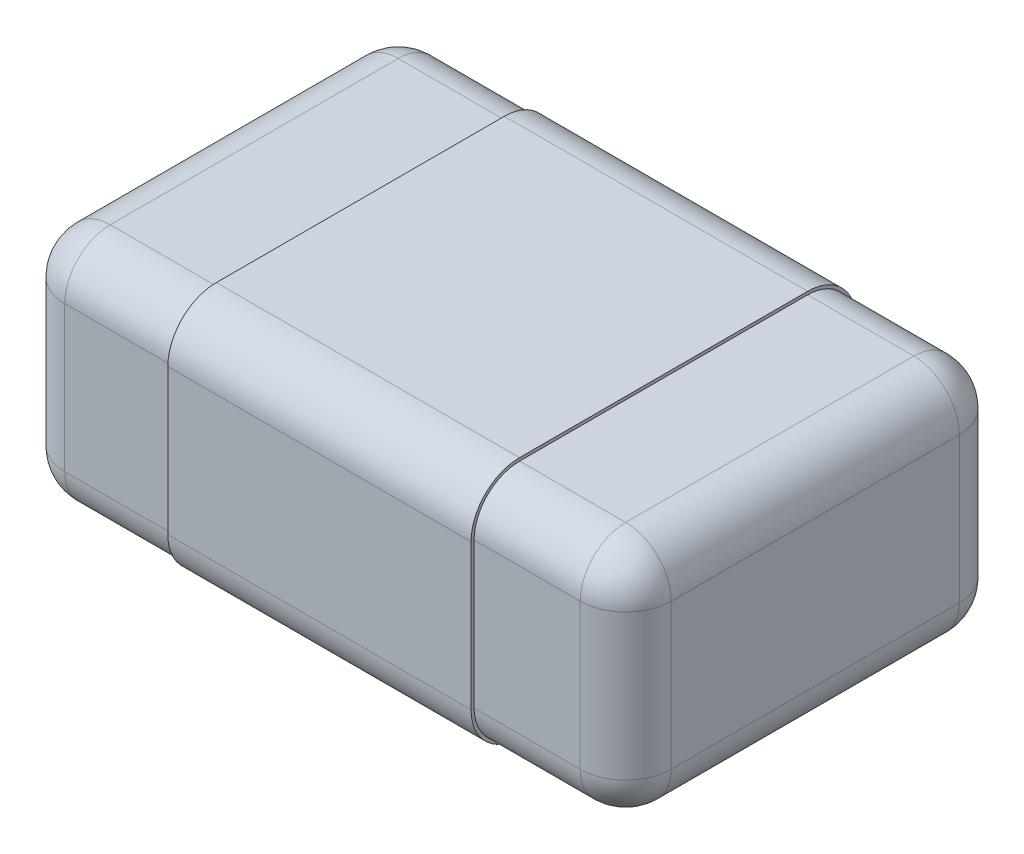
from build123d import *

# Parameters (mm, degrees)
ESBO_O1_W                     = 2
ESBO_O1_H                     = 1.25
RESSALTO_EXTRUS_O1_DEPTH      = 0.78
FILETE1_R                     = 0.15
RESSALTO_EXTRUS_O4_DEPTH      = 0.5
RESSALTO_EXTRUS_O4_DEPTH_BACK = 0.5


with BuildPart() as part:
    # Esboço1 → Ressalto-extrusão1 (new body)
    with BuildSketch(Plane(origin=(0, 0, 0), x_dir=(1, 0, 0), z_dir=(0, 1, 0))):
        Rectangle(ESBO_O1_W, ESBO_O1_H)
    extrude(amount=-RESSALTO_EXTRUS_O1_DEPTH)

    # Filete1
    filete1_edges = [part.edges().sort_by_distance(p)[0] for p in [
        (1, -0.78, 0),
        (0, -0.78, -0.625),
        (-1, -0.78, 0),
        (0, 0, -0.625),
        (1, 0, 0),
        (0, 0, 0.625),
        (-1, 0, 0),
        (0, -0.78, 0.625),
        (-1, -0.39, -0.625),
        (1, -0.39, -0.625),
        (1, -0.39, 0.625),
        (-1, -0.39, 0.625),
    ]]
    fillet(filete1_edges, radius=FILETE1_R)

    # Esboço4 → Ressalto-extrusão4 (add, two sides: drawn at the far end of the back side and taken through both)
    with BuildSketch(Plane(origin=(0, 0, 0), x_dir=(0, 0, -1), z_dir=(1, 0, 0)).offset(-RESSALTO_EXTRUS_O4_DEPTH_BACK)):
        with BuildLine():
            Line((0.635, -0.63), (0.635, -0.15))
            ThreePointArc((0.635, -0.15), (0.588137085, -0.036862915), (0.475, 0.01))
            Line((0.475, 0.01), (-0.475, 0.01))
            ThreePointArc((-0.475, 0.01), (-0.588137085, -0.036862915), (-0.635, -0.15))
            Line((-0.635, -0.15), (-0.635, -0.63))
            ThreePointArc((-0.635, -0.63), (-0.588137085, -0.743137085), (-0.475, -0.79))
            Line((-0.475, -0.79), (0.475, -0.79))
            ThreePointArc((0.475, -0.79), (0.588137085, -0.743137085), (0.635, -0.63))
        make_face()
        with BuildLine():
            Line((0.625, -0.63), (0.625, -0.15))
            ThreePointArc((0.625, -0.15), (0.581066017, -0.043933983), (0.475, 0))
            Line((0.475, 0), (-0.475, 0))
            ThreePointArc((-0.475, 0), (-0.581066017, -0.043933983), (-0.625, -0.15))
            Line((-0.625, -0.15), (-0.625, -0.63))
            ThreePointArc((-0.625, -0.63), (-0.581066017, -0.736066017), (-0.475, -0.78))
            Line((-0.475, -0.78), (0.475, -0.78))
            ThreePointArc((0.475, -0.78), (0.581066017, -0.736066017), (0.625, -0.63))
        make_face(mode=Mode.SUBTRACT)
    extrude(amount=RESSALTO_EXTRUS_O4_DEPTH + RESSALTO_EXTRUS_O4_DEPTH_BACK)


solid = part.part
